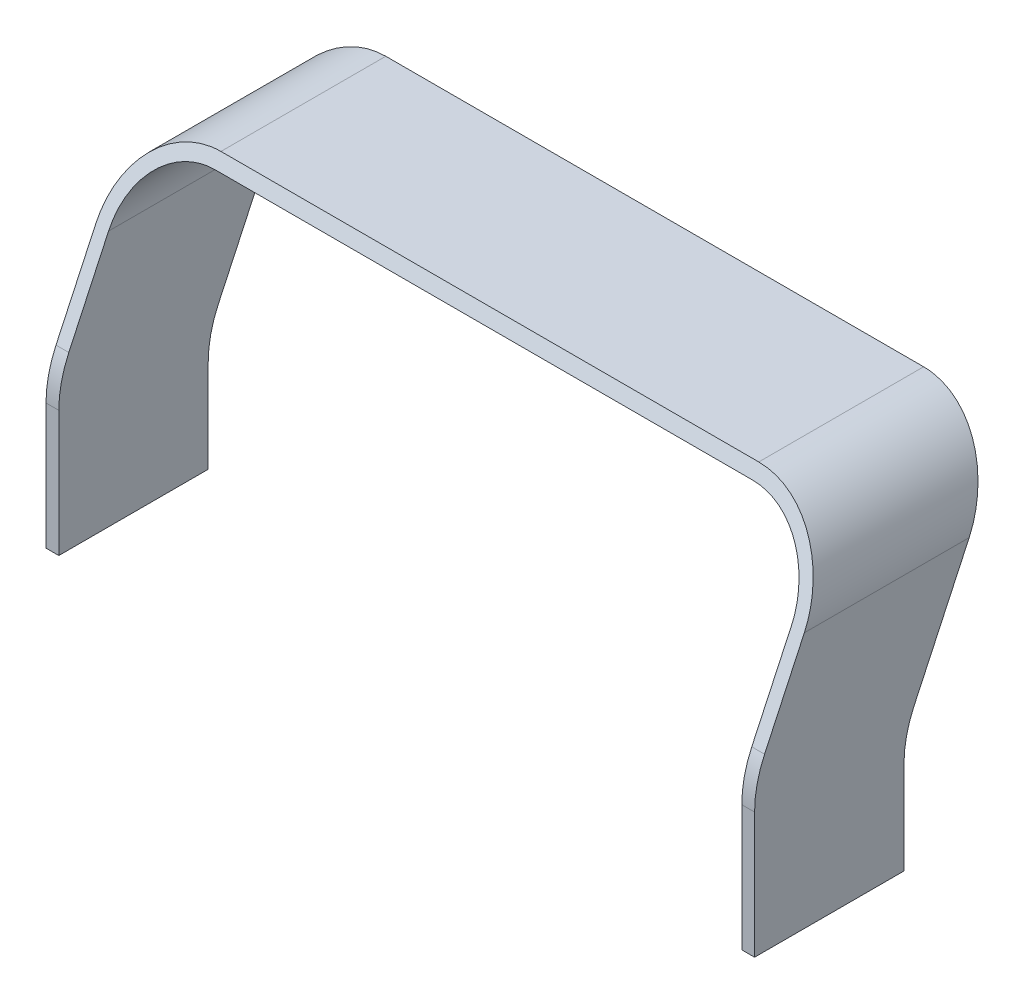
from build123d import *

# Parameters (mm, degrees)
BOSS_EXTRUDE1_DEPTH             = 70
CUT_EXTRUDE1_DEPTH              = 200.200903612
FILLET1_R                       = 25
BOSS_EXTRUDE2_REACH             = 139.891
SKETCH3_W                       = 3
SKETCH3_H                       = 8
BOSS_EXTRUDE2_DIRECTION_2_REACH = 139.891
FILLET2_R                       = 10


with BuildPart() as part:
    # Sketch1 → Boss-Extrude1 (new body)
    with BuildSketch(Plane.XY):
        with BuildLine():
            Line((-83, 5), (-83, 65))
            ThreePointArc((-83, 65), (-77.142135624, 79.142135624), (-63, 85))
            Line((-63, 85), (63, 85))
            ThreePointArc((63, 85), (77.142135624, 79.142135624), (83, 65))
            Line((83, 65), (83, 5))
            Line((83, 5), (80, 5))
            Line((80, 5), (80, 65))
            ThreePointArc((80, 65), (75.02081528, 77.02081528), (63, 82))
            Line((63, 82), (-63, 82))
            ThreePointArc((-63, 82), (-75.02081528, 77.02081528), (-80, 65))
            Line((-80, 65), (-80, 5))
            Line((-80, 5), (-83, 5))
        make_face()
    extrude(amount=BOSS_EXTRUDE1_DEPTH)

    # Sketch2 → Cut-Extrude1 (cut, through all)
    with BuildSketch(Plane.ZY.offset(83)):
        Polygon((49.016155383, 85), (70, 40), (70, 85), align=None)
        Polygon((10.397928219, 85), (35, 32.240686807), (35, 4.870884332), (0, 4.870884332), (0, 85), align=None)
    extrude(amount=-CUT_EXTRUDE1_DEPTH, mode=Mode.SUBTRACT)

    # Fillet1
    fillet1_edges = [part.edges().sort_by_distance(p)[0] for p in [
        (-81.5, 40, 70),
        (81.5, 40, 70),
        (-81.5, 32.240686807, 35),
        (81.5, 32.240686807, 35),
    ]]
    fillet(fillet1_edges, radius=FILLET1_R)

    # Sketch3 → Boss-Extrude2 (add, up to next)
    with BuildSketch(Plane(origin=(0, 0, 0), x_dir=(0, 0, -1), z_dir=(1, 0, 0)), mode=Mode.PRIVATE) as boss_extrude2_sk1:
        with Locations((-29.707041801, 81)):
            Rectangle(SKETCH3_W, SKETCH3_H)
    boss_extrude2_tool1 = extrude(boss_extrude2_sk1.sketch, amount=BOSS_EXTRUDE2_REACH, mode=Mode.PRIVATE) - part.part
    add(boss_extrude2_tool1.solids().sort_by_distance((0, 81, 29.707042))[0])

    # Sketch3 → Boss-Extrude2 direction 2 (add, up to next)
    with BuildSketch(Plane(origin=(0, 0, 0), x_dir=(0, 0, -1), z_dir=(1, 0, 0)), mode=Mode.PRIVATE) as boss_extrude2_direction_2_sk1:
        with Locations((-29.707041801, 81)):
            Rectangle(SKETCH3_W, SKETCH3_H)
    boss_extrude2_direction_2_tool1 = extrude(boss_extrude2_direction_2_sk1.sketch, amount=-BOSS_EXTRUDE2_DIRECTION_2_REACH, mode=Mode.PRIVATE) - part.part
    add(boss_extrude2_direction_2_tool1.solids().sort_by_distance((0, 81, 29.707042))[0])

    # Fillet2
    fillet2_edges = [part.edges().sort_by_distance(p)[0] for p in [
        (-75.041594579, 77, 29.707041801),
        (75.041594579, 77, 29.707041801),
    ]]
    fillet(fillet2_edges, radius=FILLET2_R)


solid = part.part
